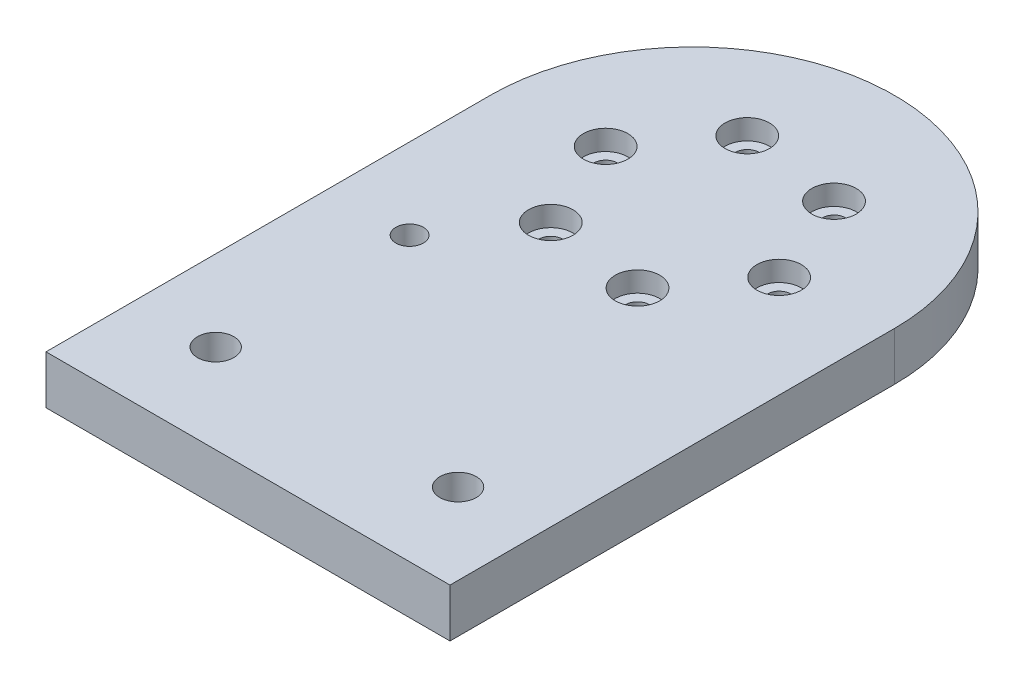
from build123d import *

# Parameters (mm, degrees)
PLACA_START                 = 34.5
SK_PLACA_W                  = 50
SK_PLACA_H                  = 36
PLACA_DEPTH                 = 6
EXTREMO_START               = 34.5
SK_EXTREMO_R                = 25
EXTREMO_DEPTH               = 6
PASANTES_M2_5_CUBO_J5_START = 34.5
SK_PASANTES_M2_5_CUBO_J5_R  = 1.45
PASANTES_M2_5_CUBO_J5_DEPTH = 6
CAJAS_M2_5_J5_START         = 38
SK_CAJAS_M2_5_J5_R          = 2.75
CAJAS_M2_5_J5_DEPTH         = 2.5
EXTENSION_PESTANAS_START    = 34.5
SK_EXTENSION_PESTANAS_W     = 50
SK_EXTENSION_PESTANAS_H     = 19
EXTENSION_PESTANAS_DEPTH    = 6
PASANTES_M4_REPISA_START    = 34.5
SK_PASANTES_M4_REPISA_R     = 2.25
PASANTES_M4_REPISA_DEPTH    = 6
PASANTE_M3_CINCHO_START     = 34.5
SK_PASANTE_M3_CINCHO_R      = 1.7
PASANTE_M3_CINCHO_DEPTH     = 6


with BuildPart() as part:
    # Sk_Placa → Placa (new body)
    with BuildSketch(Plane(origin=(0, 0, 0), x_dir=(1, 0, 0), z_dir=(0, 1, 0)).offset(PLACA_START)):
        with Locations((0, -508)):
            Rectangle(SK_PLACA_W, SK_PLACA_H)
    extrude(amount=PLACA_DEPTH)

    # Sk_Extremo → Extremo (add)
    with BuildSketch(Plane(origin=(0, 0, 0), x_dir=(1, 0, 0), z_dir=(0, 1, 0)).offset(EXTREMO_START)):
        with Locations((0, -490)):
            Circle(SK_EXTREMO_R)
    extrude(amount=EXTREMO_DEPTH)

    # Sk_Pasantes_M2-5_cubo_J5 → Pasantes_M2-5_cubo_J5 (cut)
    with BuildSketch(Plane(origin=(0, 0, 0), x_dir=(1, 0, 0), z_dir=(0, 1, 0)).offset(PASANTES_M2_5_CUBO_J5_START)):
        with Locations(Location((12.390194253, -491.653204878, 0), (0, 0, 270))):
            Circle(SK_PASANTES_M2_5_CUBO_J5_R)
        with Locations(Location((4.763379704, -501.55682542, 0), (0, 0, 270))):
            Circle(SK_PASANTES_M2_5_CUBO_J5_R)
        with Locations(Location((-7.626814549, -499.903620542, 0), (0, 0, 270))):
            Circle(SK_PASANTES_M2_5_CUBO_J5_R)
        with Locations(Location((-12.390194253, -488.346795122, 0), (0, 0, 270))):
            Circle(SK_PASANTES_M2_5_CUBO_J5_R)
        with Locations(Location((-4.763379704, -478.44317458, 0), (0, 0, 270))):
            Circle(SK_PASANTES_M2_5_CUBO_J5_R)
        with Locations(Location((7.626814549, -480.096379458, 0), (0, 0, 270))):
            Circle(SK_PASANTES_M2_5_CUBO_J5_R)
    extrude(amount=PASANTES_M2_5_CUBO_J5_DEPTH, mode=Mode.SUBTRACT)

    # Sk_Cajas_M2-5_J5 → Cajas_M2-5_J5 (cut)
    with BuildSketch(Plane(origin=(0, 0, 0), x_dir=(1, 0, 0), z_dir=(0, 1, 0)).offset(CAJAS_M2_5_J5_START)):
        with Locations(Location((12.390194253, -491.653204878, 0), (0, 0, 270))):
            Circle(SK_CAJAS_M2_5_J5_R)
        with Locations(Location((4.763379704, -501.55682542, 0), (0, 0, 270))):
            Circle(SK_CAJAS_M2_5_J5_R)
        with Locations(Location((-7.626814549, -499.903620542, 0), (0, 0, 270))):
            Circle(SK_CAJAS_M2_5_J5_R)
        with Locations(Location((-12.390194253, -488.346795122, 0), (0, 0, 270))):
            Circle(SK_CAJAS_M2_5_J5_R)
        with Locations(Location((-4.763379704, -478.44317458, 0), (0, 0, 270))):
            Circle(SK_CAJAS_M2_5_J5_R)
        with Locations(Location((7.626814549, -480.096379458, 0), (0, 0, 270))):
            Circle(SK_CAJAS_M2_5_J5_R)
    extrude(amount=CAJAS_M2_5_J5_DEPTH, mode=Mode.SUBTRACT)

    # Sk_Extension_pestanas → Extension_pestanas (add)
    with BuildSketch(Plane(origin=(0, 0, 0), x_dir=(1, 0, 0), z_dir=(0, 1, 0)).offset(EXTENSION_PESTANAS_START)):
        with Locations((0, -535.5)):
            Rectangle(SK_EXTENSION_PESTANAS_W, SK_EXTENSION_PESTANAS_H)
    extrude(amount=EXTENSION_PESTANAS_DEPTH)

    # Sk_Pasantes_M4_repisa → Pasantes_M4_repisa (cut)
    with BuildSketch(Plane(origin=(0, 0, 0), x_dir=(1, 0, 0), z_dir=(0, 1, 0)).offset(PASANTES_M4_REPISA_START)):
        with Locations(Location((-15, -534, 0), (0, 0, 270))):
            Circle(SK_PASANTES_M4_REPISA_R)
        with Locations(Location((15, -534, 0), (0, 0, 270))):
            Circle(SK_PASANTES_M4_REPISA_R)
    extrude(amount=PASANTES_M4_REPISA_DEPTH, mode=Mode.SUBTRACT)

    # Sk_Pasante_M3_cincho → Pasante_M3_cincho (cut)
    with BuildSketch(Plane(origin=(0, 0, 0), x_dir=(1, 0, 0), z_dir=(0, 1, 0)).offset(PASANTE_M3_CINCHO_START)):
        with Locations(Location((-15, -510, 0), (0, 0, 270))):
            Circle(SK_PASANTE_M3_CINCHO_R)
    extrude(amount=PASANTE_M3_CINCHO_DEPTH, mode=Mode.SUBTRACT)


solid = part.part
